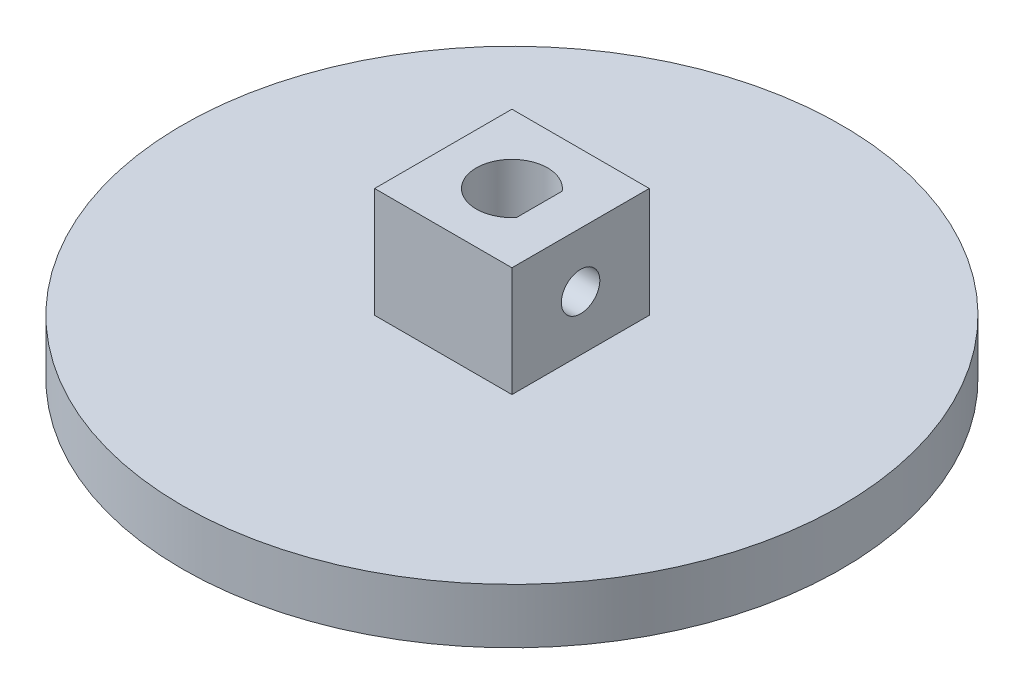
from build123d import *

# Parameters (mm, degrees)
SKETCH1_R               = 24
BOSS_EXTRUDE1_DEPTH     = 4
SKETCH2_W               = 10
SKETCH2_H               = 10
BOSS_EXTRUDE2_DEPTH     = 8
SKETCH4_R               = 1.4
CUT_EXTRUDE2_DEPTH      = 4
CUT_EXTRUDE3_DEPTH      = 35.871191548
CUT_EXTRUDE3_DEPTH_BACK = 35.871191548


with BuildPart() as part:
    # Sketch1 → Boss-Extrude1 (new body)
    with BuildSketch(Plane(origin=(0, 0, 0), x_dir=(1, 0, 0), z_dir=(0, 1, 0))):
        with Locations(Location((0, 0, 0), (0, 0, 270))):
            Circle(SKETCH1_R)
        with BuildLine():
            Line((2, 1.5), (2, -1.5))
            ThreePointArc((2, -1.5), (-2.5, 0), (2, 1.5))
        make_face(mode=Mode.SUBTRACT)
    extrude(amount=BOSS_EXTRUDE1_DEPTH)

    # Sketch2 → Boss-Extrude2 (add)
    with BuildSketch(Plane(origin=(0, 4, 0), x_dir=(1, 0, 0), z_dir=(0, 1, 0))):
        Rectangle(SKETCH2_W, SKETCH2_H)
    extrude(amount=BOSS_EXTRUDE2_DEPTH)

    # Sketch4 → Cut-Extrude2 (cut)
    with BuildSketch(Plane(origin=(5, 0, 0), x_dir=(0, 0, -1), z_dir=(1, 0, 0))):
        with Locations((0, 8)):
            Circle(SKETCH4_R)
    extrude(amount=-CUT_EXTRUDE2_DEPTH, mode=Mode.SUBTRACT)

    # Sketch3 → Cut-Extrude3 (cut, two sides: drawn at the far end of the back side and taken through both)
    with BuildSketch(Plane.XZ.offset(-4).offset(-CUT_EXTRUDE3_DEPTH_BACK)):
        with BuildLine():
            Line((2, -1.661324773), (2, 1.661324773))
            ThreePointArc((2, 1.661324773), (-2.6, 0), (2, -1.661324773))
        make_face()
    extrude(amount=CUT_EXTRUDE3_DEPTH + CUT_EXTRUDE3_DEPTH_BACK, mode=Mode.SUBTRACT)


solid = part.part
